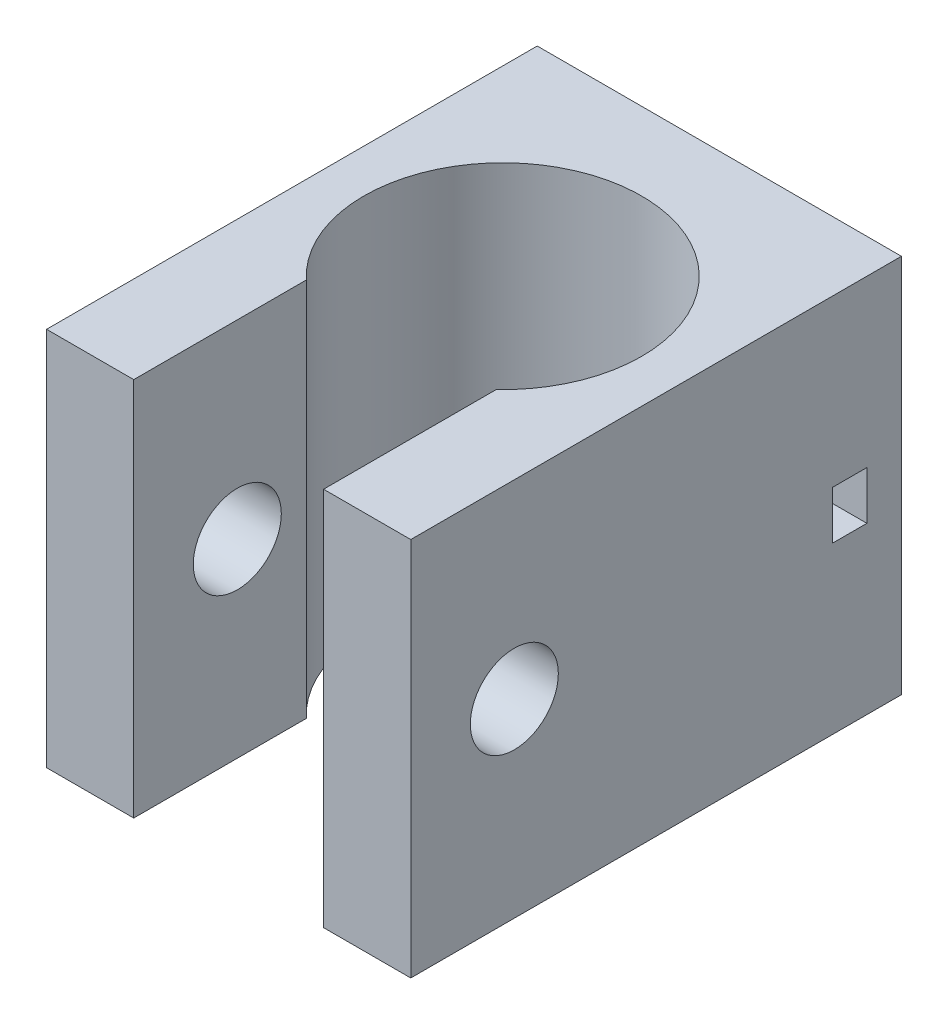
from build123d import *

# Parameters (mm, degrees)
BOSS_EXTRUDE1_DEPTH = 11
CUT_EXTRUDE1_REACH  = 30.128
SKETCH2_R           = 2.55
SKETCH4_W           = 2
SKETCH4_H           = 2.8
CUT_EXTRUDE3_DEPTH  = 21.1
SKETCH5_W           = 5
SKETCH5_H           = 5
CUT_EXTRUDE5_DEPTH  = 2


with BuildPart() as part:
    # Sketch1 → Boss-Extrude1 (new, symmetric)
    with BuildSketch(Plane(origin=(0, 0, 0), x_dir=(1, 0, 0), z_dir=(0, 1, 0))):
        with BuildLine():
            Line((-5.5, -15), (-10.55, -15))
            Line((-10.55, -15), (-10.55, 13.42813746))
            Line((-10.55, 13.42813746), (10.55, 13.42813746))
            Line((10.55, 13.42813746), (10.55, -15))
            Line((10.55, -15), (5.5, -15))
            Line((5.5, -15), (5.5, -5))
            ThreePointArc((5.5, -5), (0, 8.92813746), (-5.5, -5))
            Line((-5.5, -5), (-5.5, -15))
        make_face()
    extrude(amount=BOSS_EXTRUDE1_DEPTH, both=True)

    # Cut-Extrude1: up to this face of the body (flat: up to its plane)
    cut_extrude1_end = Plane(part.part.faces().sort_by_distance((-10.55, 0, 0.78593127))[0])
    # Sketch2 → Cut-Extrude1 (cut, up to the picked face)
    with BuildSketch(Plane(origin=(10.55, 0, 0), x_dir=(0, 0, -1), z_dir=(1, 0, 0)), mode=Mode.PRIVATE) as cut_extrude1_sk1:
        with Locations((-9, 0)):
            Circle(SKETCH2_R)
    cut_extrude1_tool1 = split(extrude(cut_extrude1_sk1.sketch, amount=-CUT_EXTRUDE1_REACH, mode=Mode.PRIVATE), bisect_by=cut_extrude1_end, keep=Keep.BOTH, mode=Mode.PRIVATE)
    add(cut_extrude1_tool1.solids().sort_by(Axis((10.55, 0, 9), (-1, 0, 0)))[0], mode=Mode.SUBTRACT)

    # Sketch4 → Cut-Extrude3 (cut)
    with BuildSketch(Plane(origin=(10.55, 0, 0), x_dir=(0, 0, -1), z_dir=(1, 0, 0))):
        with Locations((10.42813746, 0)):
            Rectangle(SKETCH4_W, SKETCH4_H)
    extrude(amount=-CUT_EXTRUDE3_DEPTH, mode=Mode.SUBTRACT)

    # Sketch5 → Cut-Extrude5 (cut)
    with BuildSketch(Plane(origin=(0, 0, -13.42813746), x_dir=(-1, 0, 0), z_dir=(0, 0, -1))):
        with Locations((0, 6)):
            Rectangle(SKETCH5_W, SKETCH5_H)
        with Locations((0, -6)):
            Rectangle(SKETCH5_W, SKETCH5_H)
    extrude(amount=-CUT_EXTRUDE5_DEPTH, mode=Mode.SUBTRACT)


solid = part.part
